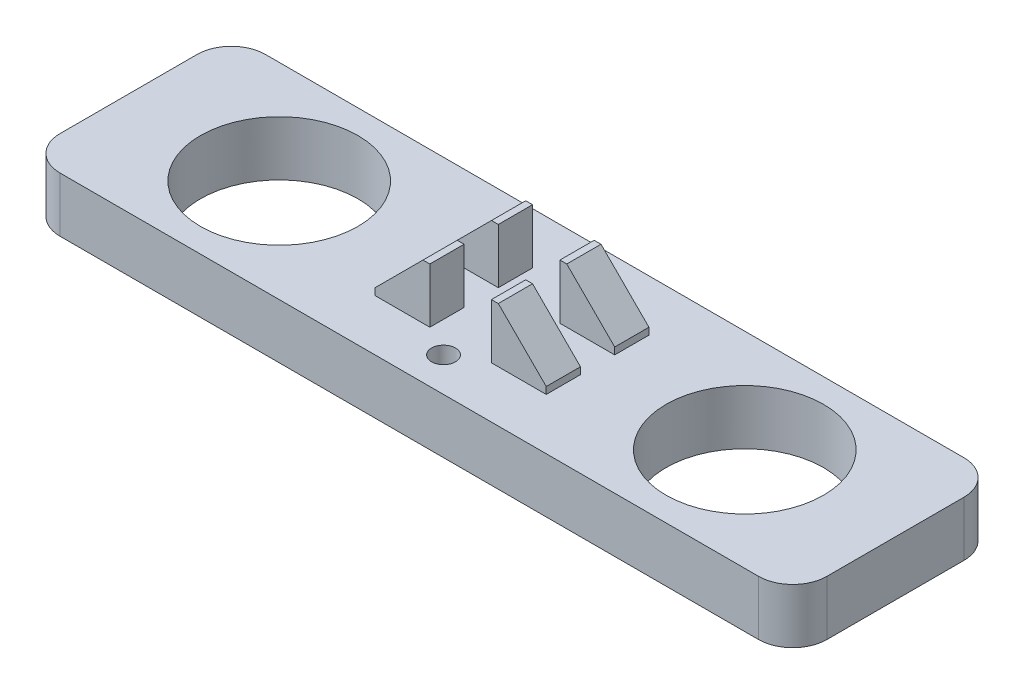
from build123d import *
from build123d.topology import SkipClean

# Parameters (mm, degrees)
SKETCH1_W                = 60
SKETCH1_H                = 30
SKETCH1_R                = 11.5
BOSS_EXTRUDE1_DEPTH      = 5
SKETCH2_R                = 1.75
CUT_EXTRUDE1_DEPTH       = 68.268120235
FILLET1_R                = 5
SKETCH6_R                = 1.75
SKETCH6_R_2              = 11.5
BOSS_EXTRUDE4_DEPTH      = 3
FILLET1_OF_MIRROR1_R     = 5
SKETCH7_W                = 8
SKETCH7_H                = 5
BOSS_EXTRUDE5_DEPTH      = 8
CHAMFER1_SIZE            = 7
CHAMFER1_OF_MIRROR2_SIZE = 7


with BuildPart() as part:
    # Sketch1 → Boss-Extrude1 (new body)
    with BuildSketch(Plane(origin=(0, 0, 0), x_dir=(1, 0, 0), z_dir=(0, 1, 0))):
        with Locations((30, 15)):
            Rectangle(SKETCH1_W, SKETCH1_H)
        with Locations(Location((22, 15, 0), (0, 0, 270))):
            Circle(SKETCH1_R, mode=Mode.SUBTRACT)
    boss_extrude1 = extrude(amount=BOSS_EXTRUDE1_DEPTH)

    # Sketch2 → Cut-Extrude1 (cut, through all)
    with BuildSketch(Plane(origin=(0, 5, 0), x_dir=(1, 0, 0), z_dir=(0, 1, 0))):
        with Locations(Location((56, 25, 0), (0, 0, 270))):
            Circle(SKETCH2_R)
        with Locations(Location((56, 5, 0), (0, 0, 270))):
            Circle(SKETCH2_R)
    cut_extrude1 = extrude(amount=-CUT_EXTRUDE1_DEPTH, mode=Mode.SUBTRACT)

    # Fillet1
    fillet1_edges = [part.edges().sort_by_distance(p)[0] for p in [
        (0, 2.5, -30),
        (0, 2.5, 0),
    ]]
    fillet(fillet1_edges, radius=FILLET1_R)

    # Sketch6 → Boss-Extrude4 (add)
    with SkipClean():  # the faces are left unmerged after this step: merging them gives an invalid solid
        with BuildSketch(Plane.XZ):
            with BuildLine():
                Line((60, -30), (60, 0))
                Line((60, 0), (5, 0))
                ThreePointArc((5, 0), (1.464466094, -1.464466094), (0, -5))
                Line((0, -5), (0, -25))
                ThreePointArc((0, -25), (1.464466094, -28.535533906), (5, -30))
                Line((5, -30), (60, -30))
            make_face()
            with Locations((56, -25)):
                Circle(SKETCH6_R, mode=Mode.SUBTRACT)
            with Locations((22, -15)):
                Circle(SKETCH6_R_2, mode=Mode.SUBTRACT)
            with Locations((56, -5)):
                Circle(SKETCH6_R, mode=Mode.SUBTRACT)
        boss_extrude4 = extrude(amount=BOSS_EXTRUDE4_DEPTH)

    # Mirror1: Boss-Extrude1, Cut-Extrude1, Boss-Extrude4 across plane
    with SkipClean():  # the faces are left unmerged after this step: merging them gives an invalid solid
        add(boss_extrude1.mirror(Plane(origin=(56, 0, 0), x_dir=(0, 0, 1), z_dir=(1, 0, 0))))
        add(cut_extrude1.mirror(Plane(origin=(56, 0, 0), x_dir=(0, 0, 1), z_dir=(1, 0, 0))), mode=Mode.SUBTRACT)
        add(boss_extrude4.mirror(Plane(origin=(56, 0, 0), x_dir=(0, 0, 1), z_dir=(1, 0, 0))))

    # Fillet1 of Mirror1
    fillet1_of_mirror1_edges = [part.edges().sort_by_distance(p)[0] for p in [
        (112, 2.5, -30),
        (112, 2.5, 0),
    ]]
    fillet(fillet1_of_mirror1_edges, radius=FILLET1_OF_MIRROR1_R)

    # Sketch7 → Boss-Extrude5 (add)
    with SkipClean():  # the faces are left unmerged after this step: merging them gives an invalid solid
        with BuildSketch(Plane(origin=(0, 5, 0), x_dir=(1, 0, 0), z_dir=(0, 1, 0))):
            with Locations((47.5, 20)):
                Rectangle(SKETCH7_W, SKETCH7_H)
            with Locations((64.5, 20)):
                Rectangle(SKETCH7_W, SKETCH7_H)
        boss_extrude5 = extrude(amount=BOSS_EXTRUDE5_DEPTH)

    # Chamfer1
    chamfer1_edges = [part.edges().sort_by_distance(p)[0] for p in [
        (43.5, 13, -20),
        (68.5, 13, -20),
    ]]
    chamfer(chamfer1_edges, length=CHAMFER1_SIZE)

    # Mirror2: Boss-Extrude5 across plane
    with SkipClean():  # the faces are left unmerged after this step: merging them gives an invalid solid
        add(boss_extrude5.mirror(Plane(origin=(0, 0, -15), x_dir=(1, 0, 0), z_dir=(0, 0, -1))))

    # Chamfer1 of Mirror2
    chamfer1_of_mirror2_edges = [part.edges().sort_by_distance(p)[0] for p in [
        (43.5, 13, -10),
        (68.5, 13, -10),
    ]]
    chamfer(chamfer1_of_mirror2_edges, length=CHAMFER1_OF_MIRROR2_SIZE)


solid = part.part
